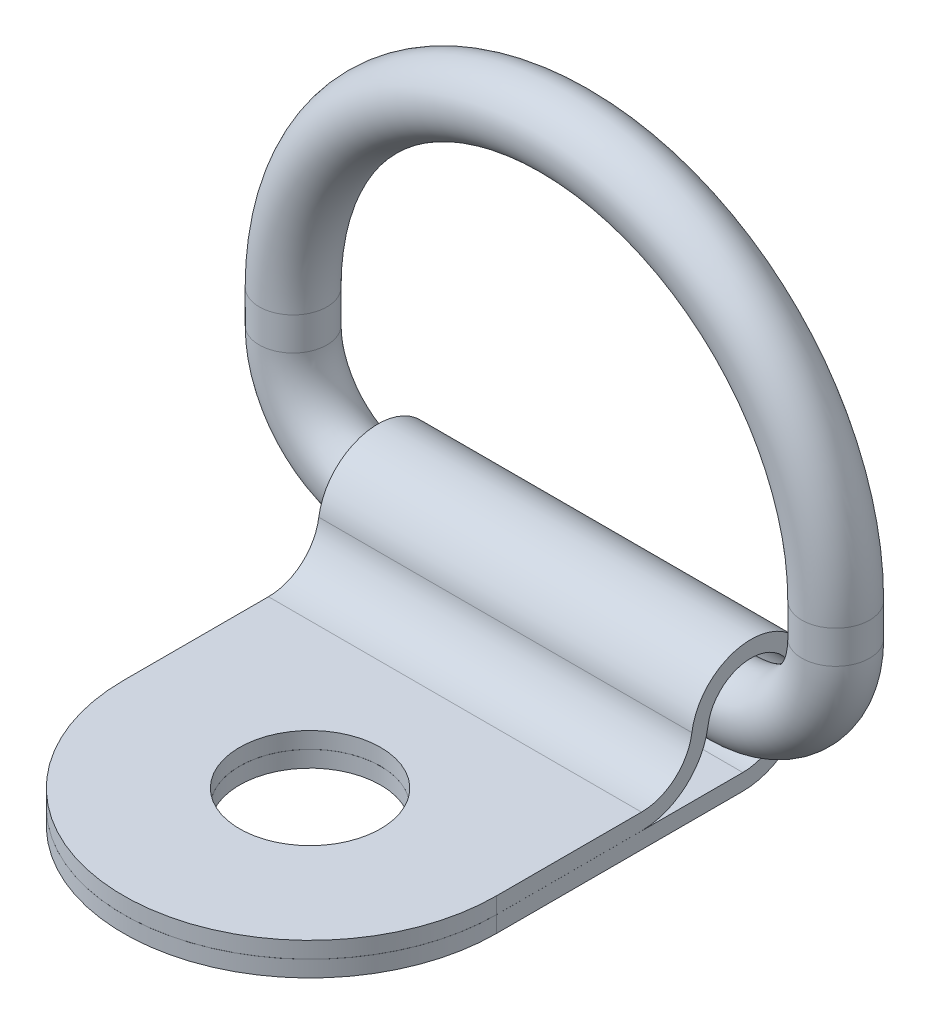
from build123d import *

# Parameters (mm, degrees)
SKETCH2_R           = 1.5875
BOSS_EXTRUDE1_DEPTH = 8.73125
SKETCH4_R           = 3.302
CUT_EXTRUDE1_DEPTH  = 35.598760474


with BuildPart() as part:
    # Sweep1: sweep along a path in Sketch1
    with BuildLine(Plane.XY) as sweep1_path:
        Line((-12.7, 6.35), (-12.7, 4.805901242))
        ThreePointArc((-12.7, 4.805901242), (-11.292384116, 1.407615884), (-7.894098758, 0))
        Line((-7.894098758, 0), (7.894098758, 0))
        ThreePointArc((7.894098758, 0), (11.292384116, 1.407615884), (12.7, 4.805901242))
        Line((12.7, 4.805901242), (12.7, 6.35))
        ThreePointArc((12.7, 6.35), (0, 19.05), (-12.7, 6.35))
    # Sketch2 → Sweep1 (sweep)
    with BuildSketch(Plane(origin=(0, 0, 0), x_dir=(0, 0, -1), z_dir=(1, 0, 0))):
        Circle(SKETCH2_R)
    sweep(path=sweep1_path.line)


with BuildPart() as body_2:
    # Sketch3 → Boss-Extrude1 (new, symmetric)
    with BuildSketch(Plane(origin=(0, 0, 0), x_dir=(0, 0, -1), z_dir=(1, 0, 0))):
        with BuildLine():
            Line((-20.6375, -3.175), (-0.381, -3.175))
            ThreePointArc((-0.381, -3.175), (1.86406403, -2.24506403), (2.794, 0))
            ThreePointArc((2.794, 0), (0.198308481, 2.786953488), (-2.765849496, 0.395616687))
            ThreePointArc((-2.765849496, 0.395616687), (-3.563066307, -1.066271632), (-5.12310759, -1.64846))
            Line((-5.12310759, -1.64846), (-20.6375, -1.64846))
            Line((-20.6375, -1.64846), (-20.6375, -2.41046))
            Line((-20.6375, -2.41046), (-5.12310759, -2.41046))
            ThreePointArc((-5.12310759, -2.41046), (-3.063853096, -1.641971355), (-2.011526906, 0.287721227))
            ThreePointArc((-2.011526906, 0.287721227), (0.14422435, 2.026875264), (2.032, 0))
            ThreePointArc((2.032, 0), (1.325248663, -1.706248663), (-0.381, -2.413))
            Line((-0.381, -2.413), (-20.6375, -2.413))
            Line((-20.6375, -2.413), (-20.6375, -3.175))
        make_face()
    extrude(amount=BOSS_EXTRUDE1_DEPTH, both=True)

    # Sketch4 → Cut-Extrude1 (cut, through all)
    with BuildSketch(Plane.XZ.offset(3.175)):
        with Locations(Location((0, 11.90625, 0), (0, 0, 270))):
            Circle(SKETCH4_R)
        with BuildLine():
            Line((-8.73125, 11.90625), (-8.73125, 20.6375))
            Line((-8.73125, 20.6375), (-8.73125, 21.9075))
            Line((-8.73125, 21.9075), (8.73125, 21.9075))
            Line((8.73125, 21.9075), (8.73125, 20.6375))
            Line((8.73125, 20.6375), (8.73125, 11.90625))
            ThreePointArc((8.73125, 11.90625), (0, 20.6375), (-8.73125, 11.90625))
        make_face()
    extrude(amount=-CUT_EXTRUDE1_DEPTH, mode=Mode.SUBTRACT)


solid = Compound([part.part, body_2.part])
